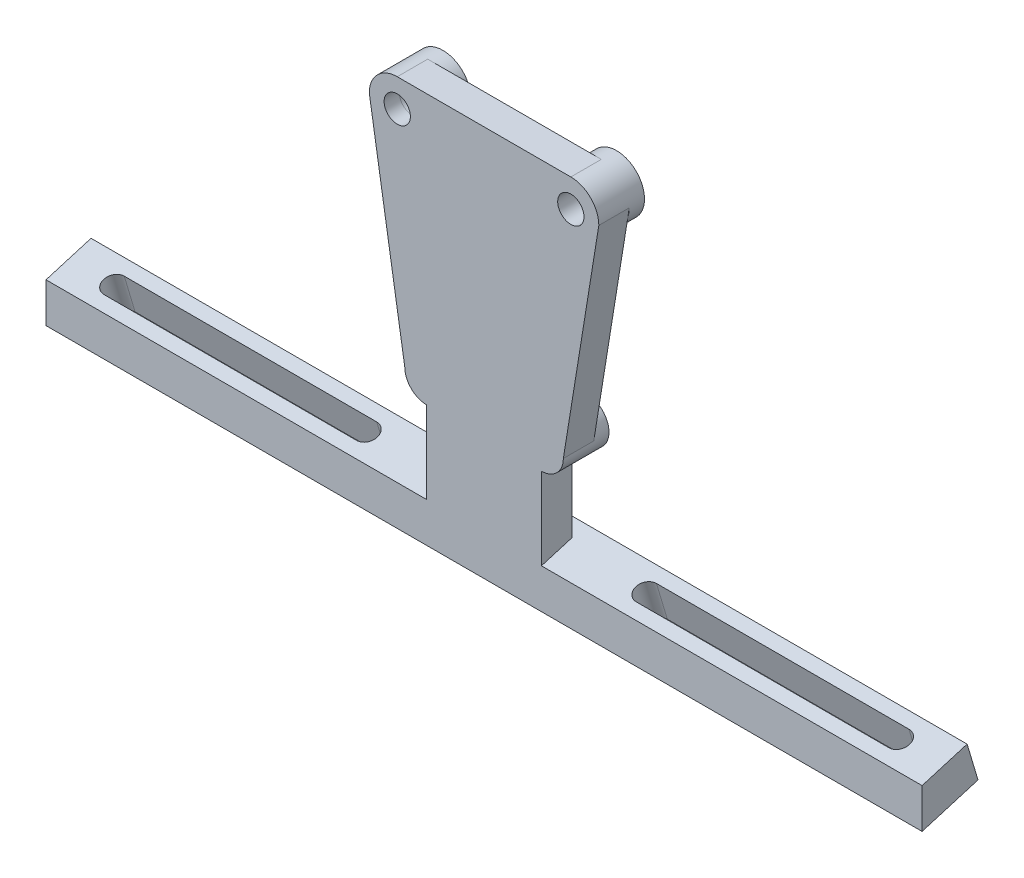
from build123d import *

# Parameters (mm, degrees)
SKETCH1_R               = 3.649213309
BOSS_EXTRUDE1_DEPTH     = 2.54
SKETCH1_R_2             = 4.666904756
SKETCH1_R_3             = 2.193652513
BOSS_EXTRUDE1_2_DEPTH   = 2.54
BOSS_EXTRUDE1_3_DEPTH   = 2.54
BOSS_EXTRUDE1_4_DEPTH   = 2.54
SKETCH2_R               = 2.193652513
SKETCH2_R_2             = 2.221197288
SKETCH2_R_3             = 3.649213309
BOSS_EXTRUDE2_DEPTH     = 2.54
SKETCH4_R               = 2.193652513
BOSS_EXTRUDE3_DEPTH     = 2.54
BOSS_EXTRUDE4_REACH     = 60.675
SKETCH5_W               = 19.155946822
SKETCH5_H               = 5.08
SKETCH6_W               = 19.155946822
SKETCH6_H               = 5.30085264
BOSS_EXTRUDE5_DEPTH     = 6.35
SKETCH7_W               = 19.155946822
SKETCH7_H               = 3.58914736
SKETCH7_H_2             = 5.30085264
BOSS_EXTRUDE6_DEPTH     = 6.349999999
CUT_EXTRUDE1_DEPTH      = 113.695579137
BOSS_EXTRUDE7_DEPTH     = 2.54
CUT_EXTRUDE2_DEPTH      = 107.988040918
CUT_EXTRUDE2_DEPTH_BACK = 107.988040918


with BuildPart() as part:
    # Sketch1 → Boss-Extrude1 (new body)
    with BuildSketch(Plane.XY):
        with Locations((-8.202026589, 4.509084108)):
            Circle(SKETCH1_R)
    extrude(amount=BOSS_EXTRUDE1_DEPTH)



with BuildPart() as body_2:
    # Sketch1 → Boss-Extrude1 2 (new body)
    with BuildSketch(Plane.XY):
        with Locations((-3.3, 41.15)):
            Circle(SKETCH1_R_2)
        with Locations((-3.3, 41.15)):
            Circle(SKETCH1_R_3, mode=Mode.SUBTRACT)
    extrude(amount=BOSS_EXTRUDE1_2_DEPTH)


with BuildPart() as body_3:
    # Sketch1 → Boss-Extrude1 3 (new body)
    with BuildSketch(Plane.XY):
        with Locations((-32.26, 41.15)):
            Circle(SKETCH1_R_2)
        with Locations((-32.26, 41.15)):
            Circle(SKETCH1_R_3, mode=Mode.SUBTRACT)
    extrude(amount=BOSS_EXTRUDE1_3_DEPTH)


with BuildPart() as body_4:
    # Sketch1 → Boss-Extrude1 4 (new body)
    with BuildSketch(Plane.XY):
        with Locations((-27.357973411, 4.509084108)):
            Circle(SKETCH1_R)
    extrude(amount=BOSS_EXTRUDE1_4_DEPTH)


with BuildPart() as part_1:
    add(part.part)

    add(body_2.part)  # Boss-Extrude2 merges body 2

    add(body_3.part)  # Boss-Extrude2 merges body 3

    add(body_4.part)  # Boss-Extrude2 merges body 4
    # Sketch2 → Boss-Extrude2 (add)
    # profile 1 of 5: a face of its own
    with BuildSketch(Plane.XY.offset(2.54)):
        with BuildLine():
            ThreePointArc((-8.202026589, 0.859870799), (-10.782410066, 7.089467585), (-4.552813279, 4.509084108))
            Line((-4.552813279, 4.509084108), (1.129473488, 39.680386235))
            ThreePointArc((1.129473488, 39.680386235), (-7.084081624, 38.418566994), (-3.3, 45.816904756))
            Line((-3.3, 45.816904756), (-32.26, 45.816904756))
            ThreePointArc((-32.26, 45.816904756), (-28.96, 44.45), (-27.593095244, 41.15))
            ThreePointArc((-27.593095244, 41.15), (-31.515665024, 36.542835423), (-36.689473488, 39.680386235))
            Line((-36.689473488, 39.680386235), (-31.007186721, 4.509084108))
            ThreePointArc((-31.007186721, 4.509084108), (-27.357973411, 8.158297418), (-23.708760102, 4.509084108))
            ThreePointArc((-23.708760102, 4.509084108), (-24.777589934, 1.928700631), (-27.357973411, 0.859870799))
            Line((-27.357973411, 0.859870799), (-8.202026589, 0.859870799))
        make_face()
    # profile 2 of 5: a face of its own
    with BuildSketch(Plane.XY.offset(2.54)):
        with BuildLine():
            ThreePointArc((-3.3, 45.816904756), (-7.084081624, 38.418566994), (1.129473488, 39.680386235))
            Line((1.129473488, 39.680386235), (1.366904756, 41.15))
            ThreePointArc((1.366904756, 41.15), (0, 44.45), (-3.3, 45.816904756))
        make_face()
        with Locations((-3.3, 41.15)):
            Circle(SKETCH2_R, mode=Mode.SUBTRACT)
    # profile 3 of 5: a face of its own
    with BuildSketch(Plane.XY.offset(2.54)):
        with BuildLine():
            ThreePointArc((-27.593095244, 41.15), (-28.96, 44.45), (-32.26, 45.816904756))
            ThreePointArc((-32.26, 45.816904756), (-35.56, 44.45), (-36.926904756, 41.15))
            Line((-36.926904756, 41.15), (-36.689473488, 39.680386235))
            ThreePointArc((-36.689473488, 39.680386235), (-31.515665024, 36.542835423), (-27.593095244, 41.15))
        make_face()
        with Locations((-32.26, 41.15)):
            Circle(SKETCH2_R_2, mode=Mode.SUBTRACT)
    # profile 4 of 5: a face of its own
    with BuildSketch(Plane.XY.offset(2.54)):
        with Locations(Location((-27.357973411, 4.509084108, 0), (0, 0, 180))):
            Circle(SKETCH2_R_3)
    # profile 5 of 5: a face of its own
    with BuildSketch(Plane.XY.offset(2.54)):
        with Locations((-8.202026589, 4.509084108)):
            Circle(SKETCH2_R_3)
    extrude(amount=BOSS_EXTRUDE2_DEPTH)

    # Sketch4 → Boss-Extrude3 (add)
    with BuildSketch(Plane.XY.offset(5.08)):
        with BuildLine():
            Line((-4.552813279, 4.509084108), (1.366904756, 41.15))
            ThreePointArc((1.366904756, 41.15), (0, 44.45), (-3.3, 45.816904756))
            Line((-3.3, 45.816904756), (-32.26, 45.816904756))
            ThreePointArc((-32.26, 45.816904756), (-35.56, 44.45), (-36.926904756, 41.15))
            Line((-36.926904756, 41.15), (-31.007186721, 4.509084108))
            ThreePointArc((-31.007186721, 4.509084108), (-29.938356889, 1.928700631), (-27.357973411, 0.859870799))
            Line((-27.357973411, 0.859870799), (-8.202026589, 0.859870799))
            ThreePointArc((-8.202026589, 0.859870799), (-5.621643111, 1.928700631), (-4.552813279, 4.509084108))
        make_face()
        with Locations((-3.3, 41.15)):
            Circle(SKETCH4_R, mode=Mode.SUBTRACT)
        with Locations((-32.26, 41.15)):
            Circle(SKETCH4_R, mode=Mode.SUBTRACT)
    extrude(amount=BOSS_EXTRUDE3_DEPTH)

    # Boss-Extrude4: up to this plane
    boss_extrude4_end = Plane(origin=(-92.143596389, -1.511792321, -30.321031804), z_dir=(0, 0.9583363932007225, 0.2856420092826512))
    # Sketch5 → Boss-Extrude4 (add, up to the surface)
    with BuildSketch(Plane.XZ.offset(-0.859870799), mode=Mode.PRIVATE) as boss_extrude4_sk1:
        with Locations((-17.78, 5.08)):
            Rectangle(SKETCH5_W, SKETCH5_H)
    boss_extrude4_tool1 = split(extrude(boss_extrude4_sk1.sketch, amount=BOSS_EXTRUDE4_REACH, mode=Mode.PRIVATE), bisect_by=boss_extrude4_end, keep=Keep.BOTH, mode=Mode.PRIVATE)
    add(boss_extrude4_tool1.solids().sort_by_distance((-17.78, 0.859871, 5.08))[0])

    # Sketch6 → Boss-Extrude5 (add)
    with BuildSketch(Plane(origin=(0, -9.68855673, -2.887773887), x_dir=(1, 0, 0), z_dir=(0, -0.9583363932007226, -0.2856420092826512))):
        with Locations((-17.78, 8.314172293)):
            Rectangle(SKETCH6_W, SKETCH6_H)
    extrude(amount=BOSS_EXTRUDE5_DEPTH)

    # Sketch7 → Boss-Extrude6 (add)
    with BuildSketch(Plane(origin=(0, -15.773992827, -4.701600646), x_dir=(1, 0, 0), z_dir=(0, -0.9583363932007226, -0.2856420092826512))):
        Polygon((-90.857973411, 5.663745973), (-27.357973411, 5.663745973), (-27.357973411, 10.964598613), (-27.357973411, 14.553745973), (-90.857973411, 14.553745973), align=None)
        with Locations((-17.78, 12.759172293)):
            Rectangle(SKETCH7_W, SKETCH7_H)
        with Locations((-17.78, 8.314172293)):
            Rectangle(SKETCH7_W, SKETCH7_H_2)
        Polygon((-8.202026589, 10.964598613), (-8.202026589, 5.663745973), (55.297973411, 5.663745973), (55.297973411, 14.553745973), (-8.202026589, 14.553745973), align=None)
    extrude(amount=-BOSS_EXTRUDE6_DEPTH)

    # Sketch9 → Cut-Extrude1 (cut, through all)
    with BuildSketch(Plane(origin=(0, 45.816904756, 0), x_dir=(1, 0, 0), z_dir=(0, 1, 0))):
        Polygon((-3.3, -7.62), (-17.78, -7.62), (-17.78, -45.955901378), (77.021856541, -45.955901378), (77.021856541, -7.62), align=None)
        Polygon((-17.78, -45.955901378), (-17.78, -7.62), (-32.26, -7.62), (-120.520571542, -7.62), (-120.520571542, -45.955901378), align=None)
    extrude(amount=-CUT_EXTRUDE1_DEPTH, mode=Mode.SUBTRACT)

    # Sketch10 → Boss-Extrude7 (add)
    with BuildSketch(Plane(origin=(0, -1.61780378, 5.427773887), x_dir=(-1, 0, 0), z_dir=(0, 0.28564200928265115, -0.9583363932007226))):
        Polygon((27.357973411, -10.109766049), (8.202026589, -10.109766049), (-55.297973411, -10.109766049), (-55.297973411, -16.459766048), (90.857973411, -16.459766048), (90.857973411, -10.109766049), align=None)
    extrude(amount=BOSS_EXTRUDE7_DEPTH)

    # Sketch11 → Cut-Extrude2 (cut, two sides: drawn at the far end of the back side and taken through both)
    with BuildSketch(Plane(origin=(0, -9.688556731, -2.887773887), x_dir=(1, 0, 0), z_dir=(0, 0.9583363932007284, 0.28564200928263184)).offset(-CUT_EXTRUDE2_DEPTH_BACK)):
        with BuildLine():
            Line((-41.109605197, -5.294172293), (-83.237973411, -5.294172293))
            ThreePointArc((-83.237973411, -5.294172293), (-84.475410278, -5.806735425), (-84.987973411, -7.044172293))
            ThreePointArc((-84.987973411, -7.044172293), (-84.475410278, -8.28160916), (-83.237973411, -8.794172293))
            Line((-83.237973411, -8.794172293), (-41.109605197, -8.794172293))
            ThreePointArc((-41.109605197, -8.794172293), (-39.359605197, -7.044172293), (-41.109605197, -5.294172293))
        make_face()
        with BuildLine():
            Line((5.549605197, -8.794172293), (47.677973411, -8.794172293))
            ThreePointArc((47.677973411, -8.794172293), (49.427973411, -7.044172293), (47.677973411, -5.294172293))
            Line((47.677973411, -5.294172293), (5.549605197, -5.294172293))
            ThreePointArc((5.549605197, -5.294172293), (3.799605197, -7.044172293), (5.549605197, -8.794172293))
        make_face()
    extrude(amount=CUT_EXTRUDE2_DEPTH + CUT_EXTRUDE2_DEPTH_BACK, mode=Mode.SUBTRACT)


solid = part_1.part
